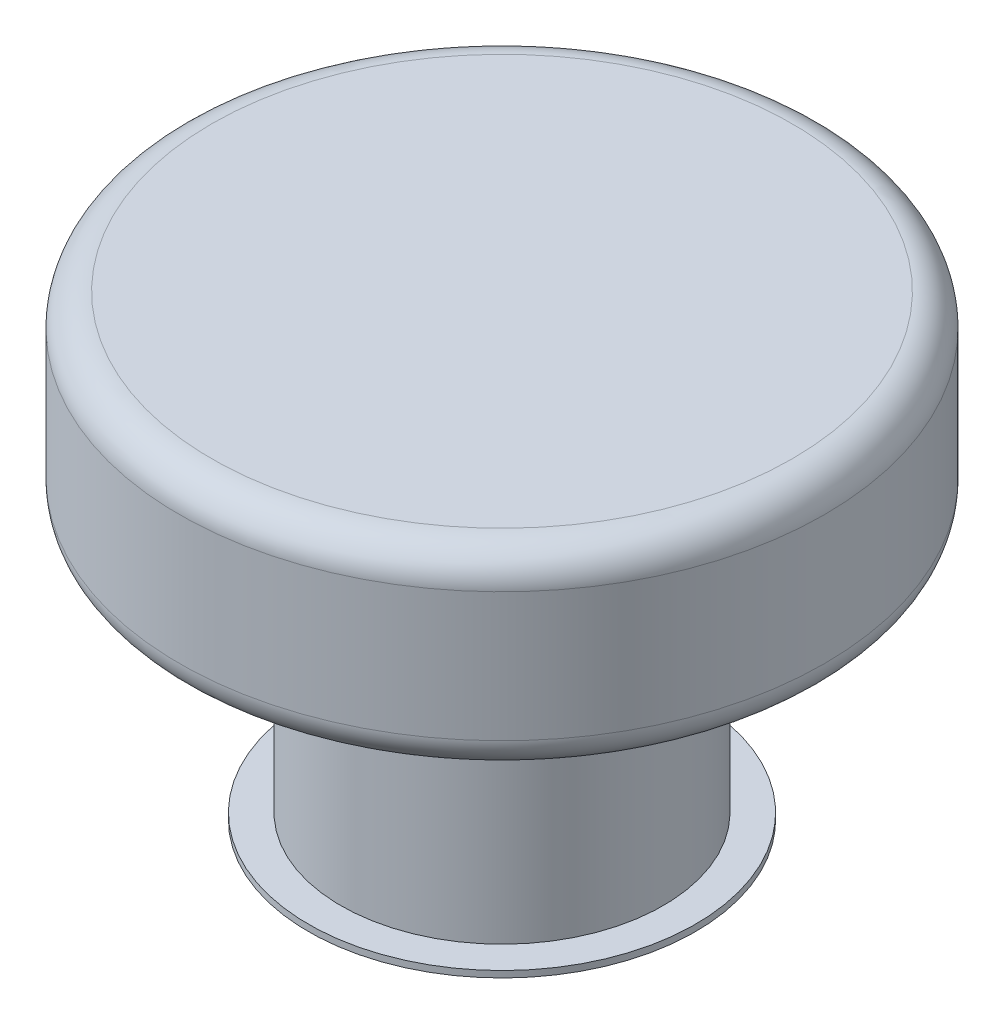
from build123d import *

# Parameters (mm, degrees)
FILLET1_R           = 0.05
SKETCH2_R           = 0.3
BOSS_EXTRUDE1_DEPTH = 0.01


with BuildPart() as part:
    # Sketch1 → Revolve1 (revolve)
    with BuildSketch(Plane.XY, mode=Mode.PRIVATE) as revolve1_sk:
        Polygon((0, 0), (0.25, 0), (0.25, 0.4), (0.5, 0.4), (0.5, 0.7), (0, 0.7), align=None)
    revolve(revolve1_sk.sketch.rotate(Axis((0, 0.7, 0), (0, -1, 0)), 180), axis=Axis((0, 0.7, 0), (0, -1, 0)))

    # Fillet1
    fillet1_edges = [part.edges().sort_by_distance(p)[0] for p in [
        (0.5, 0.7, 0),
        (0.5, 0.4, 0),
    ]]
    fillet(fillet1_edges, radius=FILLET1_R)

    # Sketch2 → Boss-Extrude1 (add)
    with BuildSketch(Plane(origin=(0, 0, 0), x_dir=(-1, 0, 0), z_dir=(0, -1, 0))):
        with Locations(Location((0, 0, 0), (0, 0, 90))):
            Circle(SKETCH2_R)
    extrude(amount=BOSS_EXTRUDE1_DEPTH)


solid = part.part
